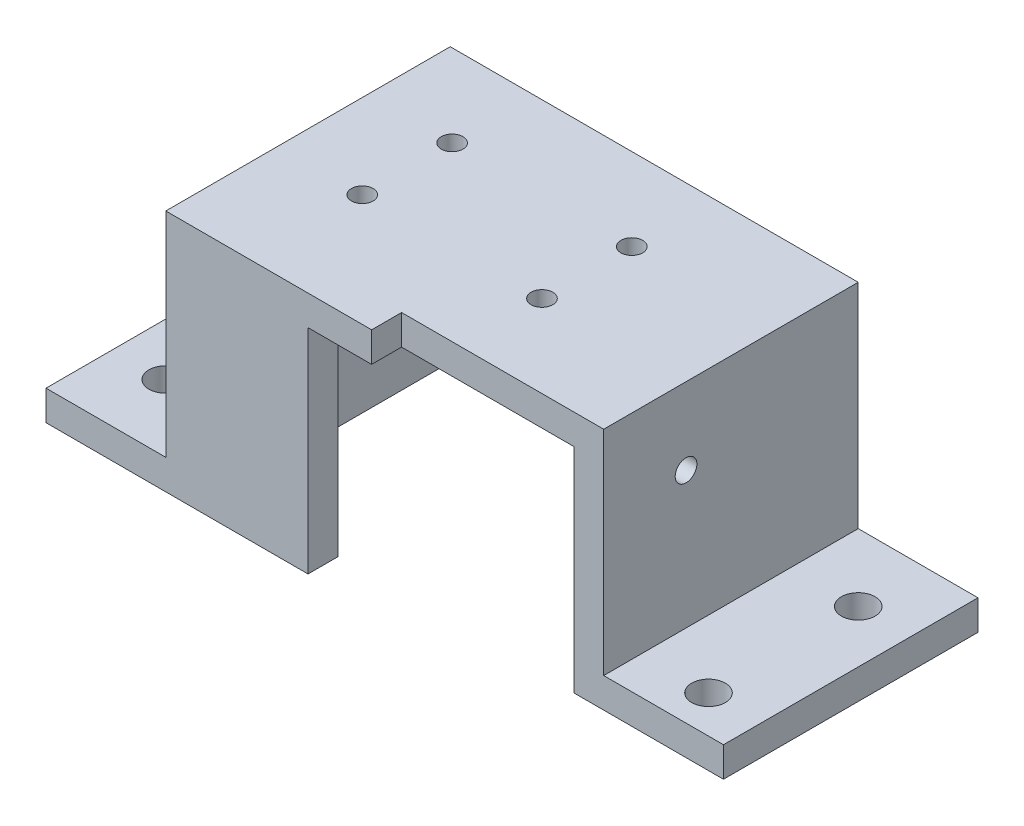
from build123d import *

# Parameters (mm, degrees)
SKETCH_31_W              = 54.5
SKETCH_31_H              = 38
EXTRUDE_11_DEPTH         = 4
SKETCH_32_W              = 4
SKETCH_32_H              = 38
EXTRUDE_12_DEPTH         = 28.5
SKETCH_33_W              = 16
SKETCH_33_H              = 38
EXTRUDE_13_DEPTH         = 4
SKETCH_34_W              = 15
SKETCH_34_H              = 4
EXTRUDE_14_DEPTH         = 28.5
HOLE_WIZARD_M2_5_1_D     = 2.9
HOLE_WIZARD_M2_5_1_DEPTH = 10
HOLE_WIZARD_M2_5_1_TIP   = 0.871247898
HOLE_WIZARD_M2_5_2_D     = 2.9
HOLE_WIZARD_M2_5_2_DEPTH = 10
HOLE_WIZARD_M2_5_2_TIP   = 0.871247898
HOLE_WIZARD_M2_5_3_D     = 2.9
HOLE_WIZARD_M2_5_3_DEPTH = 10
HOLE_WIZARD_M2_5_3_TIP   = 0.871247898
HOLE_WIZARD_M4_1_D       = 4.5
HOLE_WIZARD_M4_1_DEPTH   = 10
HOLE_WIZARD_M4_1_TIP     = 1.351936393
SKETCH_46_W              = 43
SKETCH_46_H              = 32.5
CUT_EXTRUDE_4_DEPTH      = 4


with BuildPart() as part:
    # 스케치31 → 보스-돌출11 (new body)
    with BuildSketch(Plane(origin=(0, 0, 0), x_dir=(1, 0, 0), z_dir=(0, 1, 0))):
        Rectangle(SKETCH_31_W, SKETCH_31_H)
    extrude(amount=EXTRUDE_11_DEPTH)

    # 스케치32 → 보스-돌출12 (add)
    with BuildSketch(Plane.XZ):
        with Locations((25.25, 0)):
            Rectangle(SKETCH_32_W, SKETCH_32_H)
        with Locations((-25.25, 0)):
            Rectangle(SKETCH_32_W, SKETCH_32_H)
    extrude(amount=EXTRUDE_12_DEPTH)

    # 스케치33 → 보스-돌출13 (add)
    with BuildSketch(Plane.XZ.offset(28.5)):
        with Locations((-35.25, 0)):
            Rectangle(SKETCH_33_W, SKETCH_33_H)
        with Locations((35.25, 0)):
            Rectangle(SKETCH_33_W, SKETCH_33_H)
    extrude(amount=-EXTRUDE_13_DEPTH)

    # 스케치34 → 보스-돌출14 (add)
    with BuildSketch(Plane.XZ):
        with Locations((-15.75, 17)):
            Rectangle(SKETCH_34_W, SKETCH_34_H)
    extrude(amount=EXTRUDE_14_DEPTH)

    # M2.5 여유 구멍1
    with Locations(Plane(origin=(0, 4, 0), x_dir=(1, 0, 0), z_dir=(0, 1, 0))):
        with Locations((8, 8), (8, -4), (-16, -4), (-16, 8)):
            Hole(HOLE_WIZARD_M2_5_1_D / 2, depth=HOLE_WIZARD_M2_5_1_DEPTH)
            with Locations((0, 0, -(HOLE_WIZARD_M2_5_1_DEPTH + HOLE_WIZARD_M2_5_1_TIP / 2))):  # 118° drill point
                Cone(0, HOLE_WIZARD_M2_5_1_D / 2, HOLE_WIZARD_M2_5_1_TIP, mode=Mode.SUBTRACT)

    # M2.5 여유 구멍2
    with Locations(Plane(origin=(27.25, 0, 0), x_dir=(0, 0, -1), z_dir=(1, 0, 0))):
        with Locations((-4, -6.25)):
            Hole(HOLE_WIZARD_M2_5_2_D / 2, depth=HOLE_WIZARD_M2_5_2_DEPTH)
            with Locations((0, 0, -(HOLE_WIZARD_M2_5_2_DEPTH + HOLE_WIZARD_M2_5_2_TIP / 2))):  # 118° drill point
                Cone(0, HOLE_WIZARD_M2_5_2_D / 2, HOLE_WIZARD_M2_5_2_TIP, mode=Mode.SUBTRACT)

    # M2.5 여유 구멍3
    with Locations(Plane.ZY.offset(27.25)):
        with Locations((4, -6.25), (-8, -6.25)):
            Hole(HOLE_WIZARD_M2_5_3_D / 2, depth=HOLE_WIZARD_M2_5_3_DEPTH)
            with Locations((0, 0, -(HOLE_WIZARD_M2_5_3_DEPTH + HOLE_WIZARD_M2_5_3_TIP / 2))):  # 118° drill point
                Cone(0, HOLE_WIZARD_M2_5_3_D / 2, HOLE_WIZARD_M2_5_3_TIP, mode=Mode.SUBTRACT)

    # M4 여유 구멍1
    with Locations(Plane(origin=(0, -24.5, 0), x_dir=(1, 0, 0), z_dir=(0, 1, 0))):
        with Locations((36.25, 10), (36.25, -10), (-36.25, -10), (-36.25, 10)):
            Hole(HOLE_WIZARD_M4_1_D / 2, depth=HOLE_WIZARD_M4_1_DEPTH)
            with Locations((0, 0, -(HOLE_WIZARD_M4_1_DEPTH + HOLE_WIZARD_M4_1_TIP / 2))):  # 118° drill point
                Cone(0, HOLE_WIZARD_M4_1_D / 2, HOLE_WIZARD_M4_1_TIP, mode=Mode.SUBTRACT)

    # 스케치46 → 컷-돌출4 (cut)
    with BuildSketch(Plane.XY.offset(19)):
        with Locations((21.75, -12.25)):
            Rectangle(SKETCH_46_W, SKETCH_46_H)
    extrude(amount=-CUT_EXTRUDE_4_DEPTH, mode=Mode.SUBTRACT)


solid = part.part
